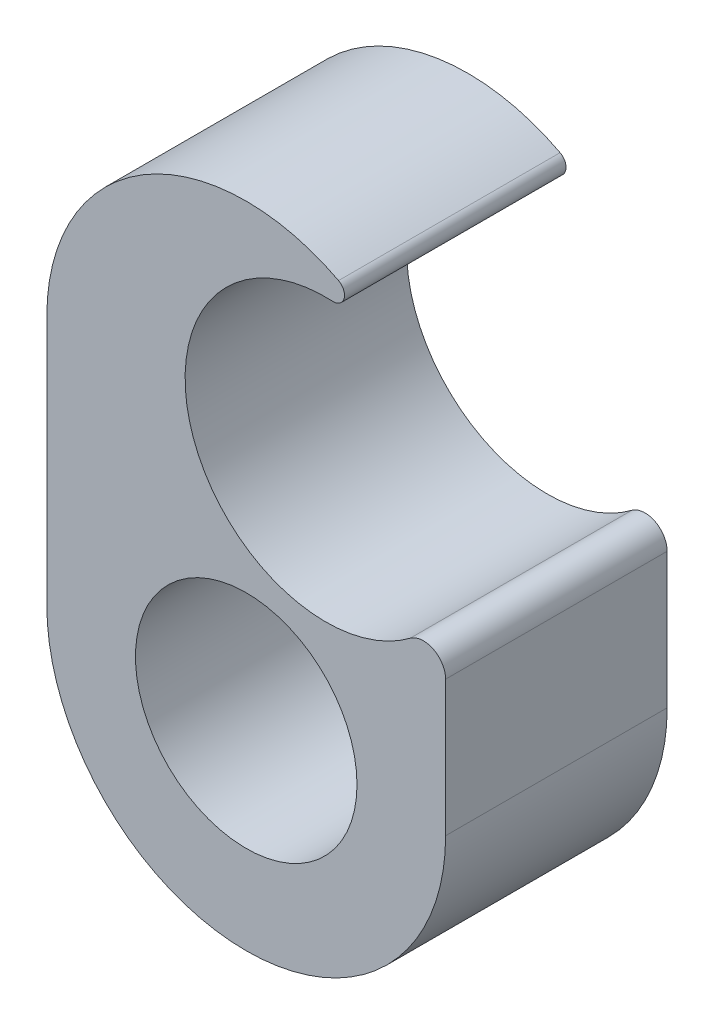
from build123d import *

# Parameters (mm, degrees)
SKETCH1_R           = 5
BOSS_EXTRUDE1_DEPTH = 10


with BuildPart() as part:
    # Sketch1 → Boss-Extrude1 (new body)
    with BuildSketch(Plane.XY):
        with BuildLine():
            Line((0, 0), (0, 11.307605315))
            ThreePointArc((0, 11.307605315), (4.336815627, 19.005313513), (13.167713668, 19.284456998))
            ThreePointArc((13.167713668, 19.284456998), (13.418597245, 18.70989145), (12.910980025, 18.341933712))
            ThreePointArc((12.910980025, 18.341933712), (6.518023633, 10.144936613), (16.400138271, 6.919341603))
            ThreePointArc((16.400138271, 6.919341603), (17.447290885, 7.013626461), (18, 6.119237918))
            Line((18, 6.119237918), (18, 0))
            ThreePointArc((18, 0), (9, -9), (0, 0))
        make_face()
        with Locations((9, 0)):
            Circle(SKETCH1_R, mode=Mode.SUBTRACT)
    extrude(amount=BOSS_EXTRUDE1_DEPTH)


solid = part.part
